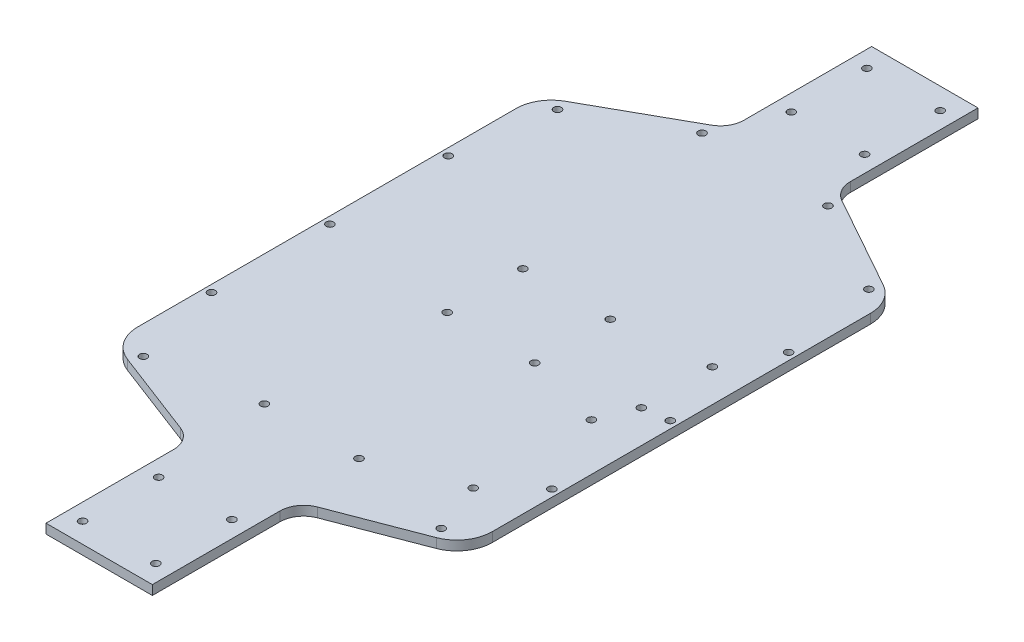
from build123d import *
from build123d.topology import SkipClean

# Parameters (mm, degrees)
BOSS_EXTRU_1_DEPTH                          = 4
FRAISAGE_POUR_VIS_T_TE_FRAIS_E_M31_AT_COUNT = 2
FRAISAGE_POUR_VIS_T_TE_FRAIS_E_M31_AT_PITCH = 37
FRAISAGE_POUR_VIS_T_TE_FRAIS_E_M31_2_COUNT  = 2
FRAISAGE_POUR_VIS_T_TE_FRAIS_E_M31_2_PITCH  = 76.249233439
FRAISAGE_POUR_VIS_T_TE_FRAIS_E_M31_3_COUNT  = 2
FRAISAGE_POUR_VIS_T_TE_FRAIS_E_M31_3_PITCH  = 84.163802195
FRAISAGE_POUR_VIS_T_TE_FRAIS_E_M31_4_COUNT  = 2
FRAISAGE_POUR_VIS_T_TE_FRAIS_E_M31_4_PITCH  = 48.918299235
FRAISAGE_POUR_VIS_T_TE_FRAIS_E_M31_5_COUNT  = 2
FRAISAGE_POUR_VIS_T_TE_FRAIS_E_M31_5_PITCH  = 32
FRAISAGE_POUR_VIS_T_TE_FRAIS_E_M31_6_COUNT  = 2
FRAISAGE_POUR_VIS_T_TE_FRAIS_E_M31_6_PITCH  = 146.221444734
FRAISAGE_POUR_VIS_T_TE_FRAIS_E_M31_7_COUNT  = 2
FRAISAGE_POUR_VIS_T_TE_FRAIS_E_M31_7_PITCH  = 149.336569199
FRAISAGE_POUR_VIS_T_TE_FRAIS_E_M31_8_COUNT  = 2
FRAISAGE_POUR_VIS_T_TE_FRAIS_E_M31_8_PITCH  = 178.221185329
FRAISAGE_POUR_VIS_T_TE_FRAIS_E_M31_9_COUNT  = 2
FRAISAGE_POUR_VIS_T_TE_FRAIS_E_M31_9_PITCH  = 180.785759671
FRAISAGE_POUR_VIS_T_TE_FRAIS_E_M31_10_COUNT = 2
FRAISAGE_POUR_VIS_T_TE_FRAIS_E_M31_10_PITCH = 93.722010844
FRAISAGE_POUR_VIS_T_TE_FRAIS_E_M31_11_COUNT = 2
FRAISAGE_POUR_VIS_T_TE_FRAIS_E_M31_11_PITCH = 71.254220114
FRAISAGE_POUR_VIS_T_TE_FRAIS_E_M31_12_COUNT = 2
FRAISAGE_POUR_VIS_T_TE_FRAIS_E_M31_12_PITCH = 81.138523202
FRAISAGE_POUR_VIS_T_TE_FRAIS_E_M31_13_COUNT = 2
FRAISAGE_POUR_VIS_T_TE_FRAIS_E_M31_13_PITCH = 110.207887466
FRAISAGE_POUR_VIS_T_TE_FRAIS_E_M31_14_COUNT = 2
FRAISAGE_POUR_VIS_T_TE_FRAIS_E_M31_14_PITCH = 120.180990857
FRAISAGE_POUR_VIS_T_TE_FRAIS_E_M31_15_COUNT = 2
FRAISAGE_POUR_VIS_T_TE_FRAIS_E_M31_15_PITCH = 126.594083229
FRAISAGE_POUR_VIS_T_TE_FRAIS_E_M31_16_COUNT = 2
FRAISAGE_POUR_VIS_T_TE_FRAIS_E_M31_16_PITCH = 126.717880504
FRAISAGE_POUR_VIS_T_TE_FRAIS_E_M31_17_COUNT = 2
FRAISAGE_POUR_VIS_T_TE_FRAIS_E_M31_17_PITCH = 104.212570966
FRAISAGE_POUR_VIS_T_TE_FRAIS_E_M31_18_COUNT = 2
FRAISAGE_POUR_VIS_T_TE_FRAIS_E_M31_18_PITCH = 111.926492077
FRAISAGE_POUR_VIS_T_TE_FRAIS_E_M31_19_COUNT = 2
FRAISAGE_POUR_VIS_T_TE_FRAIS_E_M31_19_PITCH = 96.715892614
FRAISAGE_POUR_VIS_T_TE_FRAIS_E_M31_20_COUNT = 2
FRAISAGE_POUR_VIS_T_TE_FRAIS_E_M31_20_PITCH = 72.361814356
FRAISAGE_POUR_VIS_T_TE_FRAIS_E_M31_21_COUNT = 2
FRAISAGE_POUR_VIS_T_TE_FRAIS_E_M31_21_PITCH = 80.151308017
FRAISAGE_POUR_VIS_T_TE_FRAIS_E_M31_22_COUNT = 2
FRAISAGE_POUR_VIS_T_TE_FRAIS_E_M31_22_PITCH = 87.174955693
FRAISAGE_POUR_VIS_T_TE_FRAIS_E_M31_23_COUNT = 2
FRAISAGE_POUR_VIS_T_TE_FRAIS_E_M31_23_PITCH = 57.642630925
FRAISAGE_POUR_VIS_T_TE_FRAIS_E_M31_24_COUNT = 2
FRAISAGE_POUR_VIS_T_TE_FRAIS_E_M31_24_PITCH = 91.32999562
FRAISAGE_POUR_VIS_T_TE_FRAIS_E_M31_25_COUNT = 2
FRAISAGE_POUR_VIS_T_TE_FRAIS_E_M31_25_PITCH = 70.407159437


with BuildPart() as part:
    # Esquisse1 → Boss.-Extru.1 (new body)
    with BuildSketch(Plane.XZ):
        with BuildLine():
            Line((22.5, 171.3), (22.5, 117.3))
            ThreePointArc((22.5, 117.3), (24.261102018, 111.632499665), (28.924112009, 107.961208586))
            Line((28.924112009, 107.961208586), (65.363831986, 94.008187121))
            ThreePointArc((65.363831986, 94.008187121), (72.358346973, 88.501250502), (75, 80))
            Line((75, 80), (75, -80))
            ThreePointArc((75, -80), (72.937073199, -87.591583303), (67.31571506, -93.095049185))
            Line((67.31571506, -93.095049185), (27.622856627, -115.26996721))
            ThreePointArc((27.622856627, -115.26996721), (23.875284534, -118.938944464), (22.5, -124))
            Line((22.5, -124), (22.5, -178))
            Line((22.5, -178), (-22.5, -178))
            Line((-22.5, -178), (-22.5, -124))
            ThreePointArc((-22.5, -124), (-23.875284534, -118.938944464), (-27.622856627, -115.26996721))
            Line((-27.622856627, -115.26996721), (-67.31571506, -93.095049185))
            ThreePointArc((-67.31571506, -93.095049185), (-72.937073199, -87.591583303), (-75, -80))
            Line((-75, -80), (-75, 80))
            ThreePointArc((-75, 80), (-72.358346973, 88.501250502), (-65.363831986, 94.008187121))
            Line((-65.363831986, 94.008187121), (-28.924112009, 107.961208586))
            ThreePointArc((-28.924112009, 107.961208586), (-24.261102018, 111.632499665), (-22.5, 117.3))
            Line((-22.5, 117.3), (-22.5, 171.3))
            Line((-22.5, 171.3), (22.5, 171.3))
        make_face()
    extrude(amount=BOSS_EXTRU_1_DEPTH)

    # Esquisse2 → Fraisage pour vis à tête fraisée M31 (revolve, cut)
    with BuildSketch(Plane(origin=(-14.85, -4, 9.22), x_dir=(0, 0, -1), z_dir=(1, 0, 0))):
        Polygon((0, 0), (0, 4), (1.6, 4), (1.6, 1.7), (2.9, 0.4), (2.9, 0), align=None)
    fraisage_pour_vis_t_te_frais_e_m31 = revolve(axis=Axis((-14.85, -10.35, 9.22), (0, 1, 0)), mode=Mode.SUBTRACT)

    # Fraisage pour vis à tête fraisée M31 at: Fraisage pour vis à tête fraisée M31 ×2
    with Locations(*[(i * FRAISAGE_POUR_VIS_T_TE_FRAIS_E_M31_AT_PITCH, 0, 0) for i in range(1, FRAISAGE_POUR_VIS_T_TE_FRAIS_E_M31_AT_COUNT)]):
        add(fraisage_pour_vis_t_te_frais_e_m31, mode=Mode.SUBTRACT)

    # Fraisage pour vis _ t_te frais_e M31 2: Fraisage pour vis à tête fraisée M31 ×2
    with Locations(*[Vector(0.9967313318766692, 0, -0.08078769742579317) * (i * FRAISAGE_POUR_VIS_T_TE_FRAIS_E_M31_2_PITCH) for i in range(1, FRAISAGE_POUR_VIS_T_TE_FRAIS_E_M31_2_COUNT)]):
        add(fraisage_pour_vis_t_te_frais_e_m31, mode=Mode.SUBTRACT)

    # Fraisage pour vis _ t_te frais_e M31 3: Fraisage pour vis à tête fraisée M31 ×2
    with Locations(*[Vector(0.903001029153611, 0, -0.429638384397297) * (i * FRAISAGE_POUR_VIS_T_TE_FRAIS_E_M31_3_PITCH) for i in range(1, FRAISAGE_POUR_VIS_T_TE_FRAIS_E_M31_3_COUNT)]):
        add(fraisage_pour_vis_t_te_frais_e_m31, mode=Mode.SUBTRACT)

    # Fraisage pour vis _ t_te frais_e M31 4: Fraisage pour vis à tête fraisée M31 ×2
    with Locations(*[Vector(0.7563631724521444, 0, -0.6541519329315842) * (i * FRAISAGE_POUR_VIS_T_TE_FRAIS_E_M31_4_PITCH) for i in range(1, FRAISAGE_POUR_VIS_T_TE_FRAIS_E_M31_4_COUNT)]):
        add(fraisage_pour_vis_t_te_frais_e_m31, mode=Mode.SUBTRACT)

    # Fraisage pour vis _ t_te frais_e M31 5: Fraisage pour vis à tête fraisée M31 ×2
    with Locations(*[(0, 0, -i * FRAISAGE_POUR_VIS_T_TE_FRAIS_E_M31_5_PITCH) for i in range(1, FRAISAGE_POUR_VIS_T_TE_FRAIS_E_M31_5_COUNT)]):
        add(fraisage_pour_vis_t_te_frais_e_m31, mode=Mode.SUBTRACT)

    # Fraisage pour vis _ t_te frais_e M31 6: Fraisage pour vis à tête fraisée M31 ×2
    with Locations(*[Vector(-0.004445312390285126, 0, -0.9999901195500648) * (i * FRAISAGE_POUR_VIS_T_TE_FRAIS_E_M31_6_PITCH) for i in range(1, FRAISAGE_POUR_VIS_T_TE_FRAIS_E_M31_6_COUNT)]):
        add(fraisage_pour_vis_t_te_frais_e_m31, mode=Mode.SUBTRACT)

    # Fraisage pour vis _ t_te frais_e M31 7: Fraisage pour vis à tête fraisée M31 ×2
    with Locations(*[Vector(0.2032322033569929, 0, -0.9791305691881251) * (i * FRAISAGE_POUR_VIS_T_TE_FRAIS_E_M31_7_PITCH) for i in range(1, FRAISAGE_POUR_VIS_T_TE_FRAIS_E_M31_7_COUNT)]):
        add(fraisage_pour_vis_t_te_frais_e_m31, mode=Mode.SUBTRACT)

    # Fraisage pour vis _ t_te frais_e M31 8: Fraisage pour vis à tête fraisée M31 ×2
    with Locations(*[Vector(-0.003647153388643399, 0, -0.9999933491139628) * (i * FRAISAGE_POUR_VIS_T_TE_FRAIS_E_M31_8_PITCH) for i in range(1, FRAISAGE_POUR_VIS_T_TE_FRAIS_E_M31_8_COUNT)]):
        add(fraisage_pour_vis_t_te_frais_e_m31, mode=Mode.SUBTRACT)

    # Fraisage pour vis _ t_te frais_e M31 9: Fraisage pour vis à tête fraisée M31 ×2
    with Locations(*[Vector(0.16787826682338555, 0, -0.9858077335507042) * (i * FRAISAGE_POUR_VIS_T_TE_FRAIS_E_M31_9_PITCH) for i in range(1, FRAISAGE_POUR_VIS_T_TE_FRAIS_E_M31_9_COUNT)]):
        add(fraisage_pour_vis_t_te_frais_e_m31, mode=Mode.SUBTRACT)

    # Fraisage pour vis _ t_te frais_e M31 10: Fraisage pour vis à tête fraisée M31 ×2
    with Locations(*[Vector(-0.5140271894002647, 0, 0.8577738912774534) * (i * FRAISAGE_POUR_VIS_T_TE_FRAIS_E_M31_10_PITCH) for i in range(1, FRAISAGE_POUR_VIS_T_TE_FRAIS_E_M31_10_COUNT)]):
        add(fraisage_pour_vis_t_te_frais_e_m31, mode=Mode.SUBTRACT)

    # Fraisage pour vis _ t_te frais_e M31 11: Fraisage pour vis à tête fraisée M31 ×2
    with Locations(*[Vector(-0.8020577575406399, 0, 0.5972464763972075) * (i * FRAISAGE_POUR_VIS_T_TE_FRAIS_E_M31_11_PITCH) for i in range(1, FRAISAGE_POUR_VIS_T_TE_FRAIS_E_M31_11_COUNT)]):
        add(fraisage_pour_vis_t_te_frais_e_m31, mode=Mode.SUBTRACT)

    # Fraisage pour vis _ t_te frais_e M31 12: Fraisage pour vis à tête fraisée M31 ×2
    with Locations(*[Vector(-0.7043510005461847, 0, -0.7098518634402452) * (i * FRAISAGE_POUR_VIS_T_TE_FRAIS_E_M31_12_PITCH) for i in range(1, FRAISAGE_POUR_VIS_T_TE_FRAIS_E_M31_12_COUNT)]):
        add(fraisage_pour_vis_t_te_frais_e_m31, mode=Mode.SUBTRACT)

    # Fraisage pour vis _ t_te frais_e M31 13: Fraisage pour vis à tête fraisée M31 ×2
    with Locations(*[Vector(-0.4627851347160459, 0, -0.8864704840466214) * (i * FRAISAGE_POUR_VIS_T_TE_FRAIS_E_M31_13_PITCH) for i in range(1, FRAISAGE_POUR_VIS_T_TE_FRAIS_E_M31_13_COUNT)]):
        add(fraisage_pour_vis_t_te_frais_e_m31, mode=Mode.SUBTRACT)

    # Fraisage pour vis _ t_te frais_e M31 14: Fraisage pour vis à tête fraisée M31 ×2
    with Locations(*[Vector(-0.09812659935351496, 0, -0.9951739398212329) * (i * FRAISAGE_POUR_VIS_T_TE_FRAIS_E_M31_14_PITCH) for i in range(1, FRAISAGE_POUR_VIS_T_TE_FRAIS_E_M31_14_COUNT)]):
        add(fraisage_pour_vis_t_te_frais_e_m31, mode=Mode.SUBTRACT)

    # Fraisage pour vis _ t_te frais_e M31 15: Fraisage pour vis à tête fraisée M31 ×2
    with Locations(*[Vector(0.32776375389231355, 0, -0.9447597163482464) * (i * FRAISAGE_POUR_VIS_T_TE_FRAIS_E_M31_15_PITCH) for i in range(1, FRAISAGE_POUR_VIS_T_TE_FRAIS_E_M31_15_COUNT)]):
        add(fraisage_pour_vis_t_te_frais_e_m31, mode=Mode.SUBTRACT)

    # Fraisage pour vis _ t_te frais_e M31 16: Fraisage pour vis à tête fraisée M31 ×2
    with Locations(*[Vector(0.6368680704479339, 0, -0.770972801623978) * (i * FRAISAGE_POUR_VIS_T_TE_FRAIS_E_M31_16_PITCH) for i in range(1, FRAISAGE_POUR_VIS_T_TE_FRAIS_E_M31_16_COUNT)]):
        add(fraisage_pour_vis_t_te_frais_e_m31, mode=Mode.SUBTRACT)

    # Fraisage pour vis _ t_te frais_e M31 17: Fraisage pour vis à tête fraisée M31 ×2
    with Locations(*[Vector(0.8333927394254491, 0, -0.5526812298902014) * (i * FRAISAGE_POUR_VIS_T_TE_FRAIS_E_M31_17_PITCH) for i in range(1, FRAISAGE_POUR_VIS_T_TE_FRAIS_E_M31_17_COUNT)]):
        add(fraisage_pour_vis_t_te_frais_e_m31, mode=Mode.SUBTRACT)

    # Fraisage pour vis _ t_te frais_e M31 18: Fraisage pour vis à tête fraisée M31 ×2
    with Locations(*[Vector(0.6957750607010041, 0, 0.7182597475193178) * (i * FRAISAGE_POUR_VIS_T_TE_FRAIS_E_M31_18_PITCH) for i in range(1, FRAISAGE_POUR_VIS_T_TE_FRAIS_E_M31_18_COUNT)]):
        add(fraisage_pour_vis_t_te_frais_e_m31, mode=Mode.SUBTRACT)

    # Fraisage pour vis _ t_te frais_e M31 19: Fraisage pour vis à tête fraisée M31 ×2
    with Locations(*[Vector(0.8979909883776221, 0, 0.4400138461373474) * (i * FRAISAGE_POUR_VIS_T_TE_FRAIS_E_M31_19_PITCH) for i in range(1, FRAISAGE_POUR_VIS_T_TE_FRAIS_E_M31_19_COUNT)]):
        add(fraisage_pour_vis_t_te_frais_e_m31, mode=Mode.SUBTRACT)

    # Fraisage pour vis _ t_te frais_e M31 20: Fraisage pour vis à tête fraisée M31 ×2
    with Locations(*[Vector(-0.07117013366549435, 0, 0.9974641908730537) * (i * FRAISAGE_POUR_VIS_T_TE_FRAIS_E_M31_20_PITCH) for i in range(1, FRAISAGE_POUR_VIS_T_TE_FRAIS_E_M31_20_COUNT)]):
        add(fraisage_pour_vis_t_te_frais_e_m31, mode=Mode.SUBTRACT)

    # Fraisage pour vis _ t_te frais_e M31 21: Fraisage pour vis à tête fraisée M31 ×2
    with Locations(*[Vector(0.43480263593981594, 0, 0.9005257729680967) * (i * FRAISAGE_POUR_VIS_T_TE_FRAIS_E_M31_21_PITCH) for i in range(1, FRAISAGE_POUR_VIS_T_TE_FRAIS_E_M31_21_COUNT)]):
        add(fraisage_pour_vis_t_te_frais_e_m31, mode=Mode.SUBTRACT)

    # Fraisage pour vis _ t_te frais_e M31 22: Fraisage pour vis à tête fraisée M31 ×2
    with Locations(*[Vector(0.9962723732982764, 0, -0.08626330739439464) * (i * FRAISAGE_POUR_VIS_T_TE_FRAIS_E_M31_22_PITCH) for i in range(1, FRAISAGE_POUR_VIS_T_TE_FRAIS_E_M31_22_COUNT)]):
        add(fraisage_pour_vis_t_te_frais_e_m31, mode=Mode.SUBTRACT)

    # Fraisage pour vis _ t_te frais_e M31 23: Fraisage pour vis à tête fraisée M31 ×2
    with Locations(*[Vector(-0.9914537050534457, 0, -0.1304590002100094) * (i * FRAISAGE_POUR_VIS_T_TE_FRAIS_E_M31_23_PITCH) for i in range(1, FRAISAGE_POUR_VIS_T_TE_FRAIS_E_M31_23_COUNT)]):
        add(fraisage_pour_vis_t_te_frais_e_m31, mode=Mode.SUBTRACT)

    # Fraisage pour vis _ t_te frais_e M31 24: Fraisage pour vis à tête fraisée M31 ×2
    with Locations(*[Vector(0.7648089713089968, 0, 0.6442571205700983) * (i * FRAISAGE_POUR_VIS_T_TE_FRAIS_E_M31_24_PITCH) for i in range(1, FRAISAGE_POUR_VIS_T_TE_FRAIS_E_M31_24_COUNT)]):
        add(fraisage_pour_vis_t_te_frais_e_m31, mode=Mode.SUBTRACT)

    # Fraisage pour vis _ t_te frais_e M31 25: Fraisage pour vis à tête fraisée M31 ×2
    with Locations(*[Vector(0.9920866082150472, 0, 0.12555541326586997) * (i * FRAISAGE_POUR_VIS_T_TE_FRAIS_E_M31_25_PITCH) for i in range(1, FRAISAGE_POUR_VIS_T_TE_FRAIS_E_M31_25_COUNT)]):
        add(fraisage_pour_vis_t_te_frais_e_m31, mode=Mode.SUBTRACT)

    # Esquisse4 → Enlèvement de matière-Révolution1 (revolve, cut)
    with BuildSketch(Plane(origin=(15.5, 0, 0), x_dir=(0, 0, -1), z_dir=(1, 0, 0)), mode=Mode.PRIVATE) as enl_vement_de_mati_re_r_volution1_sk:
        Polygon((-130.442327245, 1.971907347), (-128.851092213, 1.804661806), (-129.269206066, -2.173425776), (-128.112214604, -3.602191242), (-128.217747018, -4.606265087), (-131.101860514, -4.303132543), align=None)
    enl_vement_de_mati_re_r_volution1 = revolve(enl_vement_de_mati_re_r_volution1_sk.sketch.rotate(Axis((15.5, 1.971907347, 130.442327245), (0, -0.9945218953682737, 0.10452846326764959)), 180), axis=Axis((15.5, 1.971907347, 130.442327245), (0, -0.9945218953682737, 0.10452846326764959)), mode=Mode.SUBTRACT)

    # Esquisse5 → Enlèvement de matière-Révolution2 (revolve, cut)
    with SkipClean():  # the faces are left unmerged after this step: merging them gives an invalid solid
        with BuildSketch(Plane(origin=(15.5, 0, 0), x_dir=(0, 0, -1), z_dir=(1, 0, 0)), mode=Mode.PRIVATE) as enl_vement_de_mati_re_r_volution2_sk:
            Polygon((-162.75554286, 0.668908774), (-161.164307827, 0.501663233), (-161.445258889, -2.171407565), (-160.284898614, -3.602571258), (-160.3301799, -4), (-160.399257711, -4.606288173), (-163.278185176, -4.303700703), align=None)
        enl_vement_de_mati_re_r_volution2 = revolve(enl_vement_de_mati_re_r_volution2_sk.sketch.rotate(Axis((15.5, 0.668908774, 162.75554286), (0, -0.9945218953682743, 0.10452846326764464)), 180), axis=Axis((15.5, 0.668908774, 162.75554286), (0, -0.9945218953682743, 0.10452846326764464)), mode=Mode.SUBTRACT)

    # Symétrie1: Enlèvement de matière-Révolution1, Enlèvement de matière-Révolution2 across plane
    with SkipClean():  # the faces are left unmerged after this step: merging them gives an invalid solid
        add(enl_vement_de_mati_re_r_volution1.mirror(Plane(origin=(0, 0, 0), x_dir=(0, 0, 1), z_dir=(1, 0, 0))), mode=Mode.SUBTRACT)
        add(enl_vement_de_mati_re_r_volution2.mirror(Plane(origin=(0, 0, 0), x_dir=(0, 0, 1), z_dir=(1, 0, 0))), mode=Mode.SUBTRACT)


solid = part.part
